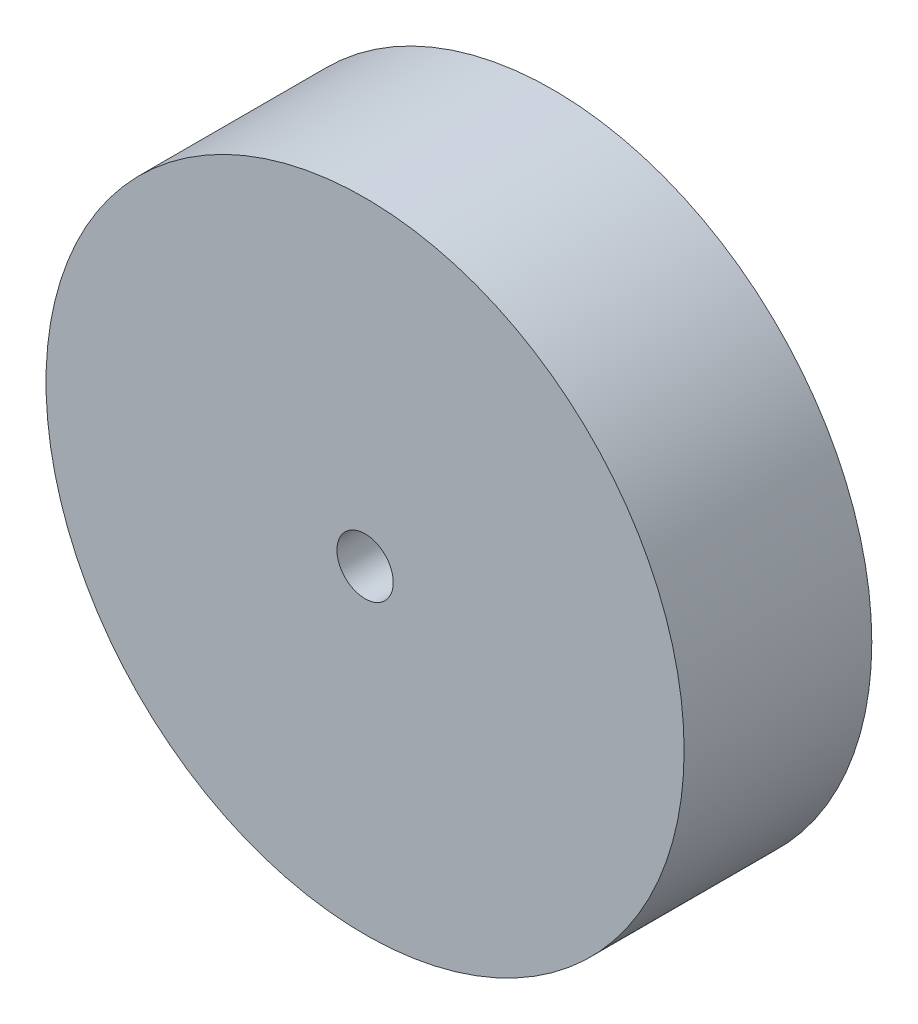
from build123d import *

# Parameters (mm, degrees)
SKETCH1_R           = 17
SKETCH1_R_2         = 1.5
BOSS_EXTRUDE1_DEPTH = 10


with BuildPart() as part:
    # Sketch1 → Boss-Extrude1 (new body)
    with BuildSketch(Plane.XY):
        Circle(SKETCH1_R)
        Circle(SKETCH1_R_2, mode=Mode.SUBTRACT)
    extrude(amount=BOSS_EXTRUDE1_DEPTH)


solid = part.part
